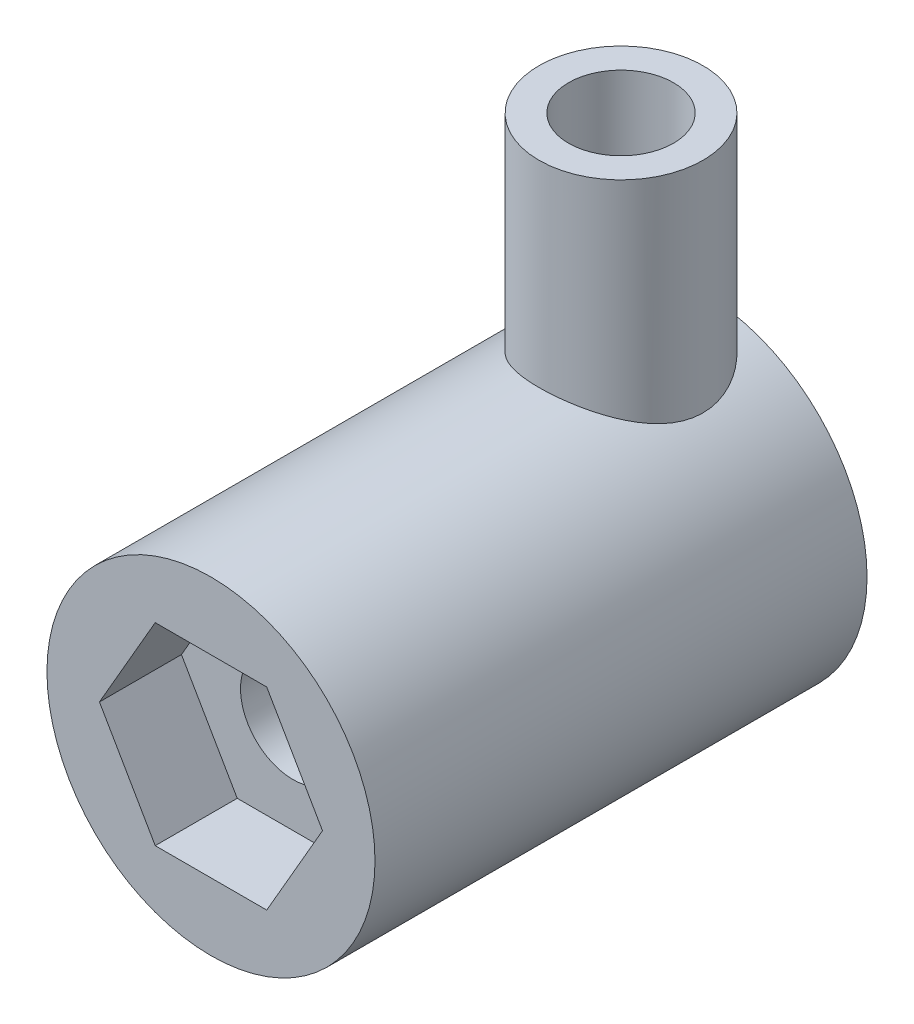
from build123d import *

# Parameters (mm, degrees)
SKETCH_1_R          = 5
SKETCH_1_R_2        = 1.6
EXTRUDE_1_DEPTH     = 15
CUT_EXTRUDE_1_DEPTH = 2.5
SKETCH_4_R          = 2.5
SKETCH_4_R_2        = 1.6
EXTRUDE_2_DEPTH     = 7


with BuildPart() as part:
    # 草图1 → 凸台-拉伸1 (new body)
    with BuildSketch(Plane.XY):
        Circle(SKETCH_1_R)
        Circle(SKETCH_1_R_2, mode=Mode.SUBTRACT)
    extrude(amount=EXTRUDE_1_DEPTH)

    # 草图2 → 切除-拉伸1 (cut)
    with BuildSketch(Plane.XY.offset(15)):
        Polygon((3.4, 0), (1.7, 2.944486373), (-1.7, 2.944486373), (-3.4, 0), (-1.7, -2.944486373), (1.7, -2.944486373), align=None)
    extrude(amount=-CUT_EXTRUDE_1_DEPTH, mode=Mode.SUBTRACT)

    # 草图4 → 凸台-拉伸2 (add)
    with BuildSketch(Plane(origin=(0, 4, 0), x_dir=(1, 0, 0), z_dir=(0, 1, 0))):
        with Locations(Location((0, -2.5, 0), (0, 0, 270))):
            Circle(SKETCH_4_R)
        with Locations(Location((0, -2.5, 0), (0, 0, 90))):
            Circle(SKETCH_4_R_2, mode=Mode.SUBTRACT)
    extrude(amount=EXTRUDE_2_DEPTH)


solid = part.part
